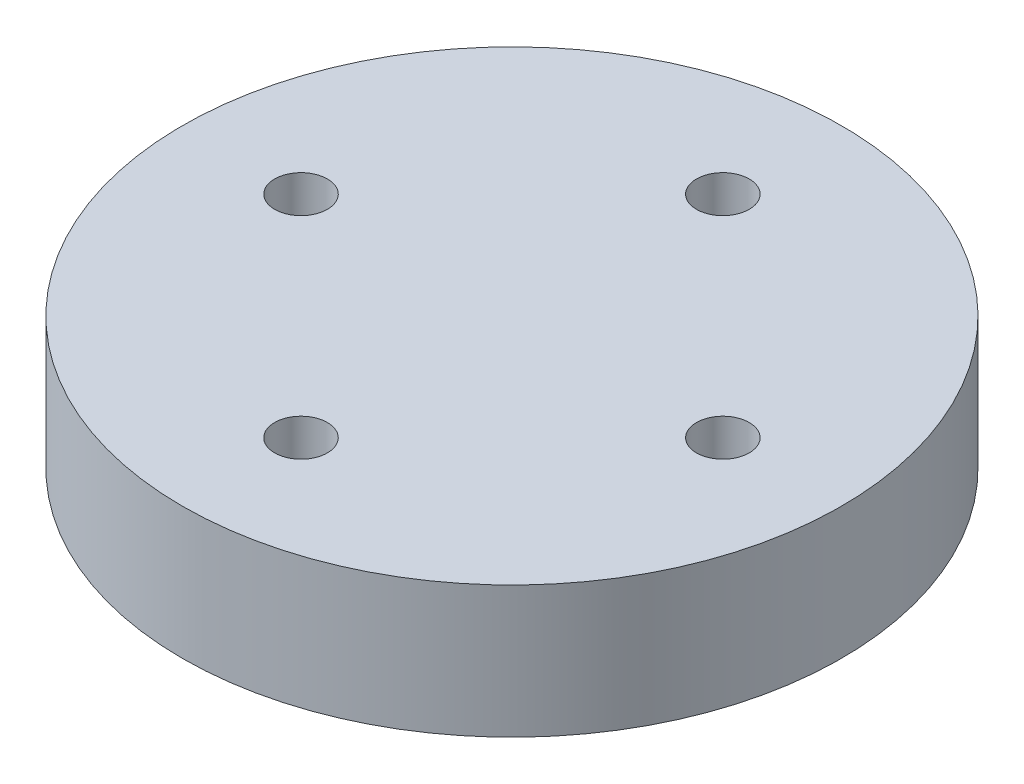
from build123d import *

# Parameters (mm, degrees)
SKETCH1_R           = 12.5
BOSS_EXTRUDE1_DEPTH = 5
SKETCH2_R           = 1
CUT_EXTRUDE1_DEPTH  = 19.371173071


with BuildPart() as part:
    # Sketch1 → Boss-Extrude1 (new body)
    with BuildSketch(Plane(origin=(0, 0, 0), x_dir=(1, 0, 0), z_dir=(0, 1, 0))):
        with Locations(Location((0, 0, 0), (0, 0, 270))):
            Circle(SKETCH1_R)
    extrude(amount=BOSS_EXTRUDE1_DEPTH)

    # Sketch2 → Cut-Extrude1 (cut, through all)
    with BuildSketch(Plane(origin=(0, 5, 0), x_dir=(1, 0, 0), z_dir=(0, 1, 0))):
        with Locations(Location((0, 8, 0), (0, 0, 270))):
            Circle(SKETCH2_R)
        with Locations(Location((8, 0, 0), (0, 0, 270))):
            Circle(SKETCH2_R)
        with Locations(Location((0, -8, 0), (0, 0, 270))):
            Circle(SKETCH2_R)
        with Locations(Location((-8, 0, 0), (0, 0, 270))):
            Circle(SKETCH2_R)
    extrude(amount=-CUT_EXTRUDE1_DEPTH, mode=Mode.SUBTRACT)


solid = part.part
